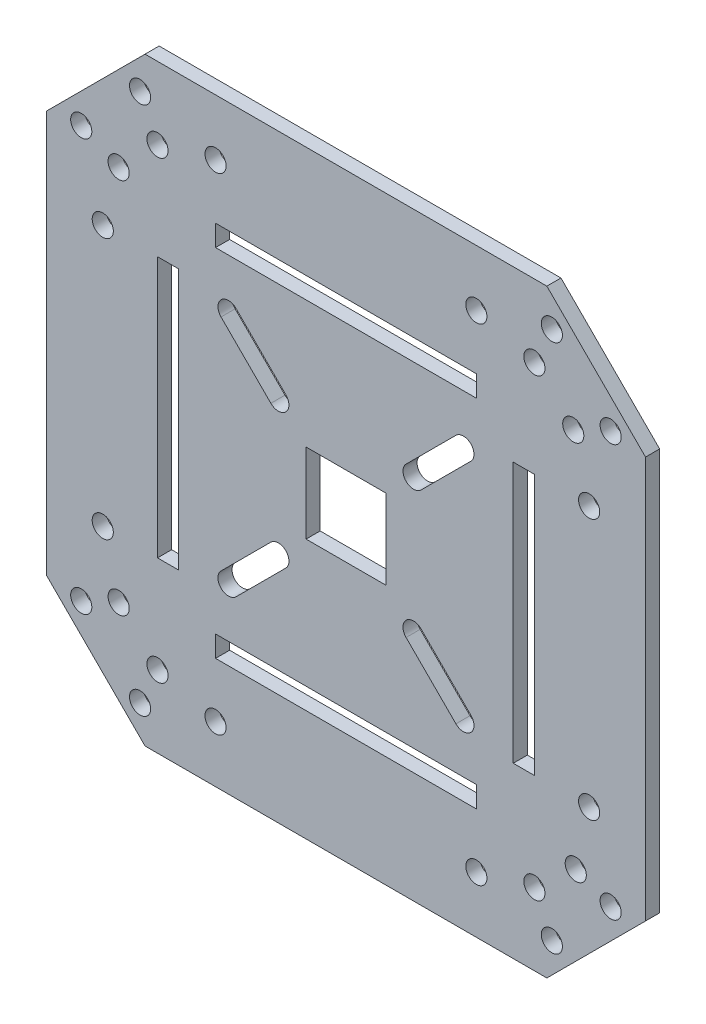
from build123d import *

# Parameters (mm, degrees)
SKETCH_1_W          = 85
SKETCH_1_H          = 85
EXTRUDE_1_DEPTH     = 2
CUT_EXTRUDE_1_DEPTH = 3
SKETCH_4_R          = 1.5
CUT_EXTRUDE_2_DEPTH = 3
SKETCH_5_R          = 1.5
CUT_EXTRUDE_3_DEPTH = 2
SKETCH_6_W          = 37
SKETCH_6_H          = 3
SKETCH_6_W_2        = 3
SKETCH_6_H_2        = 37
SKETCH_6_W_3        = 11.313708498
SKETCH_6_H_3        = 11.313708498
CUT_EXTRUDE_4_DEPTH = 2


with BuildPart() as part:
    # 草图1 → 凸台-拉伸1 (new body)
    with BuildSketch(Plane.XY):
        with Locations((42.5, 42.5)):
            Rectangle(SKETCH_1_W, SKETCH_1_H)
    extrude(amount=EXTRUDE_1_DEPTH)

    # 草图2 → 切除-拉伸1 (cut)
    with BuildSketch(Plane.XY):
        Polygon((0, 85), (14, 85), (0, 71), align=None)
        Polygon((0, 0), (14, 0), (0, 14), align=None)
        Polygon((85, 85), (71, 85), (85, 71), align=None)
        Polygon((85, 0), (85, 14), (71, 0), align=None)
    extrude(amount=CUT_EXTRUDE_1_DEPTH, mode=Mode.SUBTRACT)

    # 草图4 → 切除-拉伸2 (cut)
    with BuildSketch(Plane.XY):
        with Locations(Location((13.292893219, 80.050252532, 0), (0, 0, 180))):
            Circle(SKETCH_4_R)
        with Locations(Location((4.949747468, 71.707106781, 0), (0, 0, 180))):
            Circle(SKETCH_4_R)
        with Locations(Location((10.253048327, 69.232233047, 0), (0, 0, 180))):
            Circle(SKETCH_4_R)
        with Locations(Location((15.767766953, 74.746951673, 0), (0, 0, 180))):
            Circle(SKETCH_4_R)
        with Locations(Location((4.949747468, 13.292893219, 0), (0, 0, 180))):
            Circle(SKETCH_4_R)
        with Locations(Location((13.292893219, 4.949747468, 0), (0, 0, 180))):
            Circle(SKETCH_4_R)
        with Locations(Location((10.253048327, 15.767766953, 0), (0, 0, 180))):
            Circle(SKETCH_4_R)
        with Locations(Location((15.767766953, 10.253048327, 0), (0, 0, 180))):
            Circle(SKETCH_4_R)
        with Locations(Location((71.707106781, 4.949747468, 0), (0, 0, 180))):
            Circle(SKETCH_4_R)
        with Locations(Location((69.232233047, 10.253048327, 0), (0, 0, 180))):
            Circle(SKETCH_4_R)
        with Locations(Location((75.100505063, 15.414213562, 0), (0, 0, 180))):
            Circle(SKETCH_4_R)
        with Locations(Location((80.050252532, 13.292893219, 0), (0, 0, 180))):
            Circle(SKETCH_4_R)
        with Locations(Location((71.707106781, 80.050252532, 0), (0, 0, 180))):
            Circle(SKETCH_4_R)
        with Locations(Location((69.232233047, 74.746951673, 0), (0, 0, 180))):
            Circle(SKETCH_4_R)
        with Locations(Location((74.746951673, 69.232233047, 0), (0, 0, 180))):
            Circle(SKETCH_4_R)
        with Locations(Location((80.050252532, 71.707106781, 0), (0, 0, 180))):
            Circle(SKETCH_4_R)
    extrude(amount=CUT_EXTRUDE_2_DEPTH, mode=Mode.SUBTRACT)

    # 草图5 → 切除-拉伸3 (cut)
    with BuildSketch(Plane.XY):
        with Locations((8, 61)):
            Circle(SKETCH_5_R)
        with Locations((8, 24)):
            Circle(SKETCH_5_R)
        with Locations((24, 8)):
            Circle(SKETCH_5_R)
        with Locations((61, 8)):
            Circle(SKETCH_5_R)
        with Locations((77, 24)):
            Circle(SKETCH_5_R)
        with Locations((77, 61)):
            Circle(SKETCH_5_R)
        with Locations((61, 77)):
            Circle(SKETCH_5_R)
        with Locations((24, 77)):
            Circle(SKETCH_5_R)
    extrude(amount=CUT_EXTRUDE_3_DEPTH, mode=Mode.SUBTRACT)

    # 草图6 → 切除-拉伸4 (cut)
    with BuildSketch(Plane.XY):
        with Locations((42.5, 17.267766953)):
            Rectangle(SKETCH_6_W, SKETCH_6_H)
        with Locations((42.5, 67.732233047)):
            Rectangle(SKETCH_6_W, SKETCH_6_H)
        with Locations((17.267766953, 42.5)):
            Rectangle(SKETCH_6_W_2, SKETCH_6_H_2)
        with Locations((67.732233047, 42.5)):
            Rectangle(SKETCH_6_W_2, SKETCH_6_H_2)
        with BuildLine():
            Line((26.899494937, 60.221825407), (33.970562748, 53.150757595))
            ThreePointArc((33.970562748, 53.150757595), (33.970562748, 51.029437252), (31.849242405, 51.029437252))
            Line((31.849242405, 51.029437252), (24.778174593, 58.100505063))
            ThreePointArc((24.778174593, 58.100505063), (24.778174593, 60.221825407), (26.899494937, 60.221825407))
        make_face()
        with BuildLine():
            Line((24.778174593, 26.899494937), (31.849242405, 33.970562748))
            ThreePointArc((31.849242405, 33.970562748), (33.970562748, 33.970562748), (33.970562748, 31.849242405))
            Line((33.970562748, 31.849242405), (26.899494937, 24.778174593))
            ThreePointArc((26.899494937, 24.778174593), (24.778174593, 24.778174593), (24.778174593, 26.899494937))
        make_face()
        with BuildLine():
            Line((60.221825407, 58.100505063), (53.150757595, 51.029437252))
            ThreePointArc((53.150757595, 51.029437252), (51.029437252, 51.029437252), (51.029437252, 53.150757595))
            Line((51.029437252, 53.150757595), (58.100505063, 60.221825407))
            ThreePointArc((58.100505063, 60.221825407), (60.221825407, 60.221825407), (60.221825407, 58.100505063))
        make_face()
        with BuildLine():
            Line((58.100505063, 24.778174593), (51.029437252, 31.849242405))
            ThreePointArc((51.029437252, 31.849242405), (51.029437252, 33.970562748), (53.150757595, 33.970562748))
            Line((53.150757595, 33.970562748), (60.221825407, 26.899494937))
            ThreePointArc((60.221825407, 26.899494937), (60.221825407, 24.778174593), (58.100505063, 24.778174593))
        make_face()
        with Locations((42.5, 42.5)):
            Rectangle(SKETCH_6_W_3, SKETCH_6_H_3)
    extrude(amount=CUT_EXTRUDE_4_DEPTH, mode=Mode.SUBTRACT)


solid = part.part
